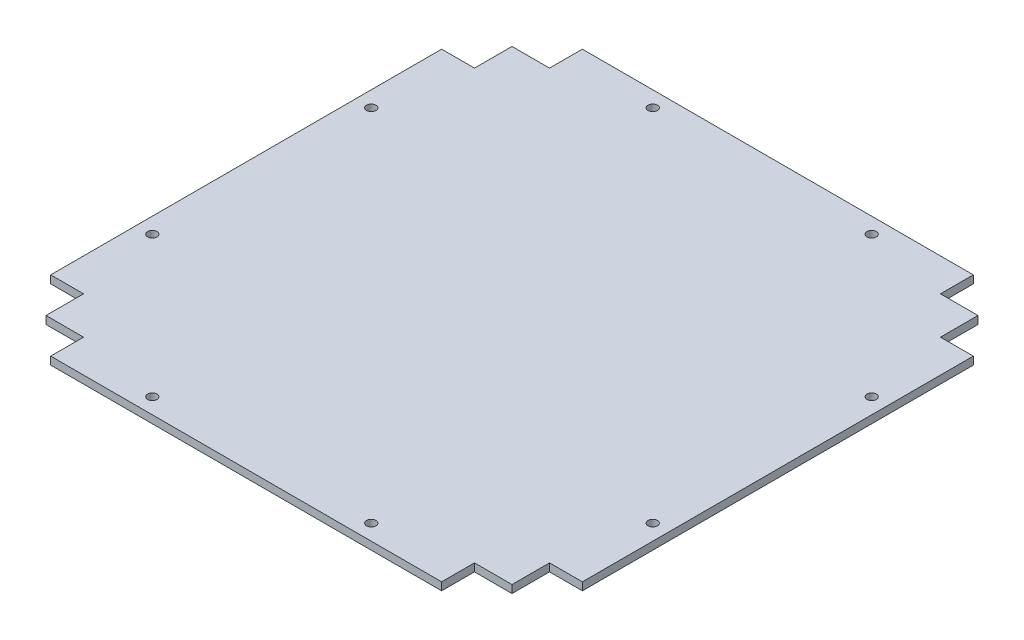
from build123d import *

# Parameters (mm, degrees)
BOSS_EXTRUDE1_DEPTH     = 5
CUT_EXTRUDE1_DEPTH      = 57
CUT_EXTRUDE1_DEPTH_BACK = 57
SKETCH2_R               = 3


with BuildPart() as part:
    # Sketch1 → Boss-Extrude1 (new body)
    with BuildSketch(Plane(origin=(0, 0, 0), x_dir=(1, 0, 0), z_dir=(0, 1, 0))):
        Polygon((0, -45), (21, -45), (21, -21), (45, -21), (45, 0), (295, 0), (295, -21), (319, -21), (319, -45), (340, -45), (340, -295), (319, -295), (319, -319), (295, -319), (295, -340), (45, -340), (45, -319), (21, -319), (21, -295), (0, -295), align=None)
    extrude(amount=BOSS_EXTRUDE1_DEPTH)

    # Sketch2 → Cut-Extrude1 (cut, two sides: drawn at the far end of the back side and taken through both)
    with BuildSketch(Plane(origin=(0, 5, 0), x_dir=(1, 0, 0), z_dir=(0, 1, 0)).offset(-CUT_EXTRUDE1_DEPTH_BACK)):
        with Locations((100, -10)):
            Circle(SKETCH2_R)
        with Locations((240, -10)):
            Circle(SKETCH2_R)
        with Locations((240, -330)):
            Circle(SKETCH2_R)
        with Locations((100, -330)):
            Circle(SKETCH2_R)
        with Locations((10, -240)):
            Circle(SKETCH2_R)
        with Locations((10, -100)):
            Circle(SKETCH2_R)
        with Locations((330, -240)):
            Circle(SKETCH2_R)
        with Locations((330, -100)):
            Circle(SKETCH2_R)
    extrude(amount=CUT_EXTRUDE1_DEPTH + CUT_EXTRUDE1_DEPTH_BACK, mode=Mode.SUBTRACT)


solid = part.part
